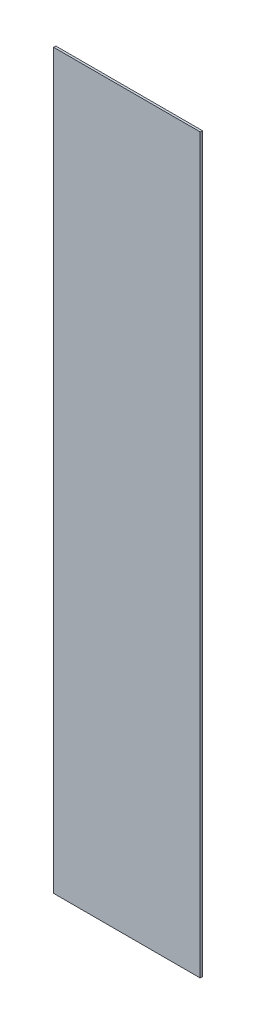
from build123d import *

# Parameters (mm, degrees)
SKETCH1_W           = 25.4
SKETCH1_H           = 0.381
BOSS_EXTRUDE1_DEPTH = 63.5


with BuildPart() as part:
    # Sketch1 → Boss-Extrude1 (new, symmetric)
    with BuildSketch(Plane(origin=(0, 0, 0), x_dir=(1, 0, 0), z_dir=(0, 1, 0))):
        Rectangle(SKETCH1_W, SKETCH1_H)
    extrude(amount=BOSS_EXTRUDE1_DEPTH, both=True)


solid = part.part
